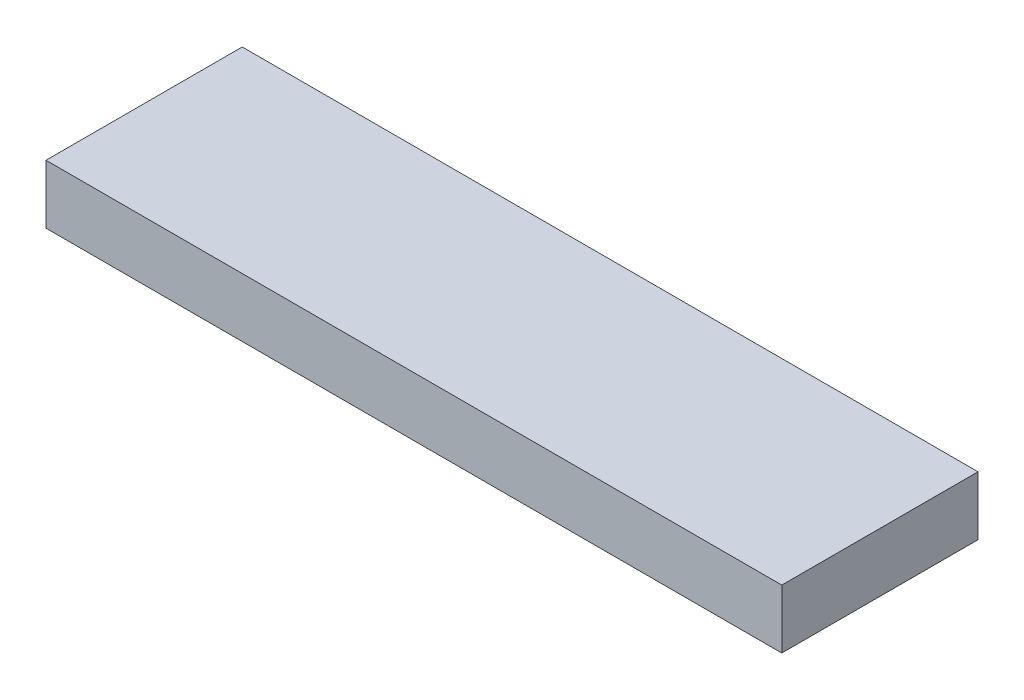
from build123d import *

# Parameters (mm, degrees)
ESBO_O1_W                = 150
ESBO_O1_H                = 40
RESSALTO_EXTRUS_O1_DEPTH = 12


with BuildPart() as part:
    # Esboço1 → Ressalto-extrusão1 (new body)
    with BuildSketch(Plane(origin=(0, 0, 0), x_dir=(1, 0, 0), z_dir=(0, 1, 0))):
        Rectangle(ESBO_O1_W, ESBO_O1_H)
    extrude(amount=RESSALTO_EXTRUS_O1_DEPTH)


solid = part.part
